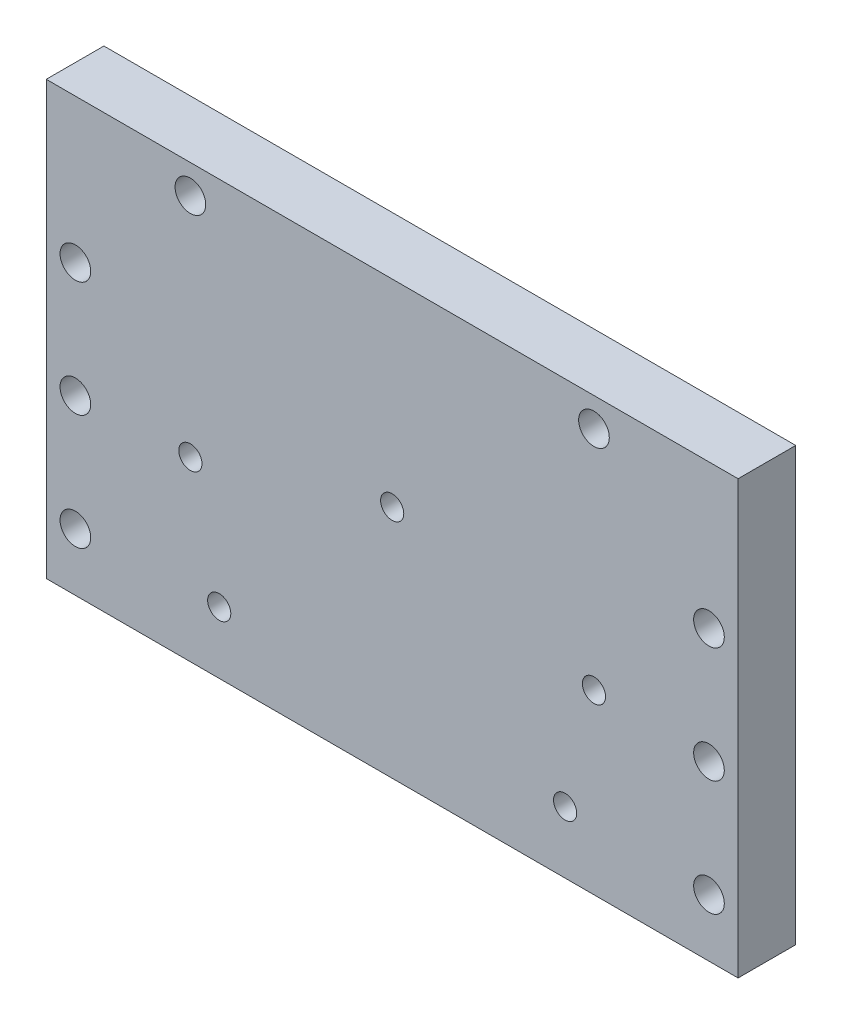
from build123d import *

# Parameters (mm, degrees)
SKETCH1_W                   = 152.4
SKETCH1_H                   = 95.25
BOSS_EXTRUDE1_DEPTH         = 6.35
F_1_4_CLEARANCE_HOLE1_D     = 6.7564
TAP_DRILL_FOR_1_4_20_TAP1_D = 5.1054


with BuildPart() as part:
    # Sketch1 → Boss-Extrude1 (new, symmetric)
    with BuildSketch(Plane.XY):
        Rectangle(SKETCH1_W, SKETCH1_H)
    extrude(amount=BOSS_EXTRUDE1_DEPTH, both=True)

    # 1/4 Clearance Hole1 (through all)
    with Locations(Plane.XY.offset(6.35)):
        with Locations((-44.45, 41.275), (44.45, 41.275), (69.785060268, 15.875), (69.785060268, -9.525), (69.785060268, -34.925), (-69.785060268, 15.875), (-69.785060268, -9.525), (-69.785060268, -34.925)):
            Hole(F_1_4_CLEARANCE_HOLE1_D / 2)

    # Tap Drill for 1/4-20 Tap1 (through all)
    with Locations(Plane.XY.offset(6.35)):
        with Locations((-38.1, -33.9852), (38.1, -33.9852), (-44.45, -8.5852), (44.45, -8.5852), (0, 4.1148)):
            Hole(TAP_DRILL_FOR_1_4_20_TAP1_D / 2)


solid = part.part
